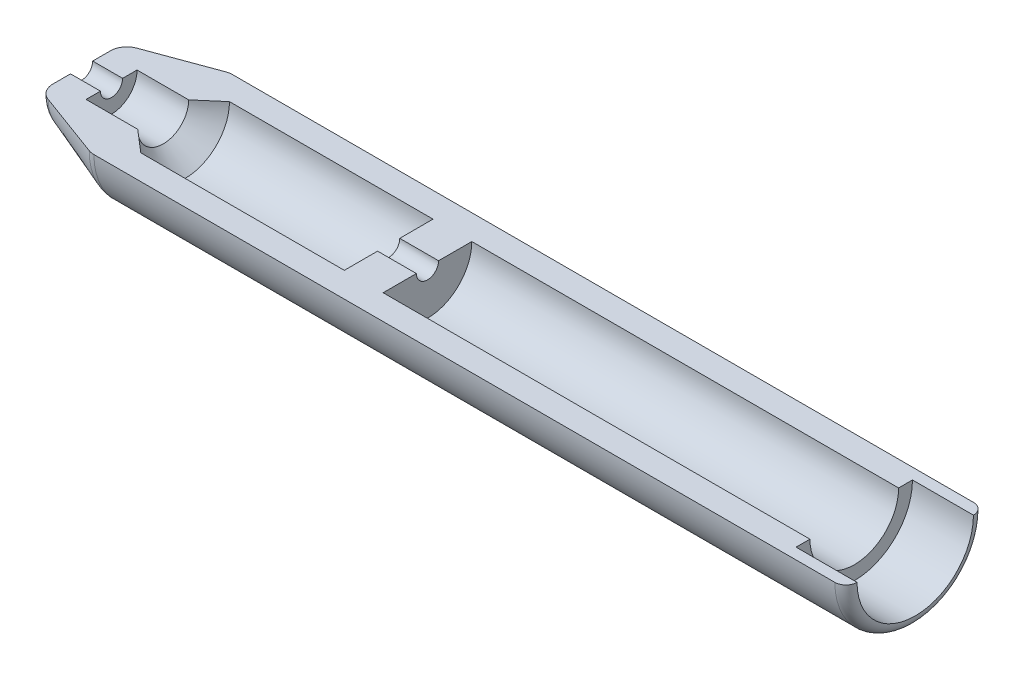
from build123d import *

# Parameters (mm, degrees)
REVOLVE1_ANGLE = 180


with BuildPart() as part:
    # Sketch1 → Revolve1 (revolve)
    with BuildSketch(Plane(origin=(0, 0, 0), x_dir=(1, 0, 0), z_dir=(0, 1, 0))):
        with BuildLine():
            Line((-2.426089026, 0.9), (-1.253621619, 1.331536072))
            ThreePointArc((-1.253621619, 1.331536072), (-1.202626886, 1.345347949), (-1.15, 1.35))
            Line((-1.15, 1.35), (12.217609628, 1.35))
            ThreePointArc((12.217609628, 1.35), (12.359030984, 1.291421356), (12.417609628, 1.15))
            Line((12.417609628, 1.15), (11.317609628, 1.15))
            Line((11.317609628, 1.15), (11.317609628, 0.9))
            Line((11.317609628, 0.9), (3.617609628, 0.9))
            Line((3.617609628, 0.9), (3.617609628, 0.3))
            Line((3.617609628, 0.3), (2.917609628, 0.3))
            Line((2.917609628, 0.3), (2.917609628, 0.9))
            Line((2.917609628, 0.9), (-0.754449261, 0.9))
            Line((-0.754449261, 0.9), (-1.15, 0.56))
            Line((-1.15, 0.56), (-2.082390372, 0.56))
            Line((-2.082390372, 0.56), (-2.082390372, 0.3))
            Line((-2.082390372, 0.3), (-2.622467407, 0.3))
            Line((-2.622467407, 0.3), (-2.622467407, 0.618463928))
            ThreePointArc((-2.622467407, 0.618463928), (-2.568522772, 0.790093637), (-2.426089026, 0.9))
        make_face()
    revolve(axis=Axis((-3.185032955, 0, -0.1), (-1, 0, 0)), revolution_arc=REVOLVE1_ANGLE)


solid = part.part
